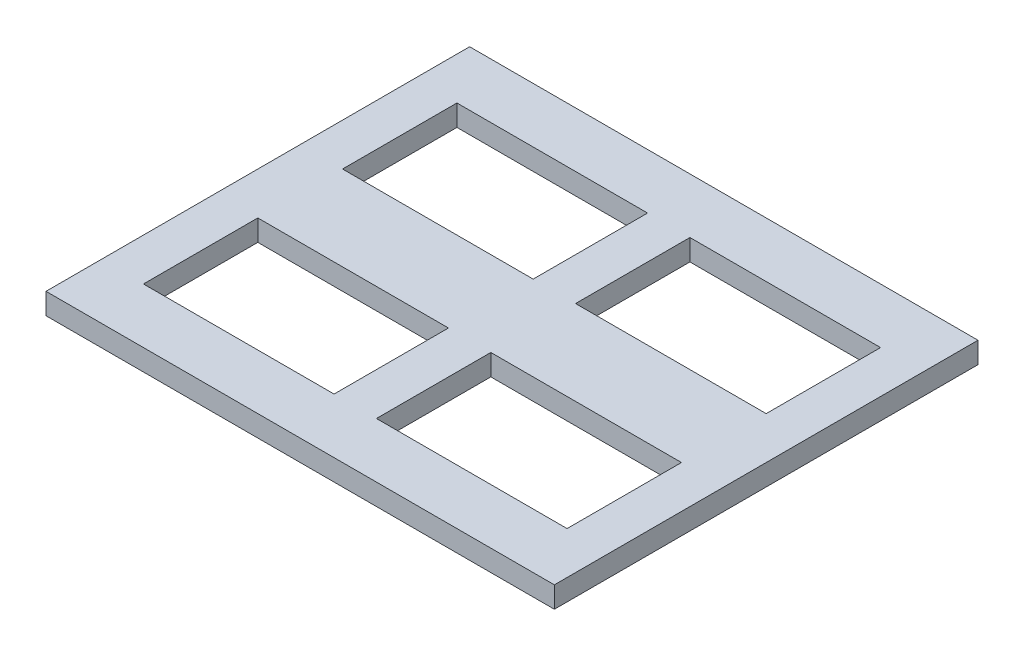
from build123d import *

# Parameters (mm, degrees)
SKETCH1_W           = 120
SKETCH1_H           = 100
SKETCH1_W_2         = 45
SKETCH1_H_2         = 27
BOSS_EXTRUDE1_DEPTH = 5


with BuildPart() as part:
    # Sketch1 → Boss-Extrude1 (new body)
    with BuildSketch(Plane(origin=(0, 0, 0), x_dir=(1, 0, 0), z_dir=(0, 1, 0))):
        Rectangle(SKETCH1_W, SKETCH1_H)
        with Locations((-27.5, 23.5)):
            Rectangle(SKETCH1_W_2, SKETCH1_H_2, mode=Mode.SUBTRACT)
        with Locations((27.5, 23.5)):
            Rectangle(SKETCH1_W_2, SKETCH1_H_2, mode=Mode.SUBTRACT)
        with Locations((-27.5, -23.5)):
            Rectangle(SKETCH1_W_2, SKETCH1_H_2, mode=Mode.SUBTRACT)
        with Locations((27.5, -23.5)):
            Rectangle(SKETCH1_W_2, SKETCH1_H_2, mode=Mode.SUBTRACT)
    extrude(amount=BOSS_EXTRUDE1_DEPTH)


solid = part.part
